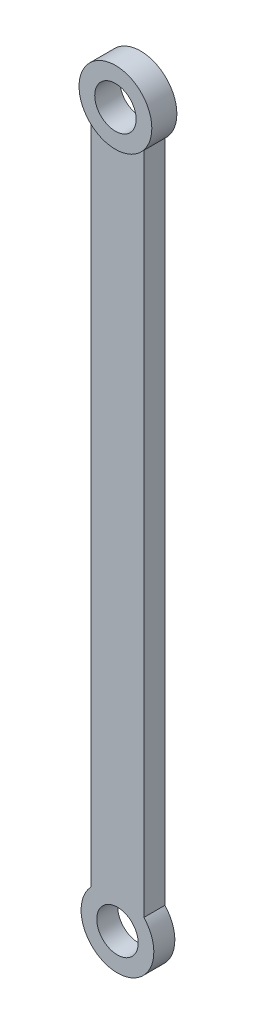
from build123d import *

# Parameters (mm, degrees)
CROQUIS1_R              = 5.125
SALIENTE_EXTRUIR1_DEPTH = 2.6
CROQUIS1_3_R            = 9
CROQUIS1_3_R_2          = 5.125
SALIENTE_EXTRUIR2_DEPTH = 3.1


with BuildPart() as part:
    # Croquis1 → Saliente-Extruir1 (new, symmetric)
    with BuildSketch(Plane.XY):
        with BuildLine():
            ThreePointArc((6.54, -6.182911935), (0, -9), (-6.54, -6.182911935))
            Line((-6.54, -6.182911935), (-6.54, -170.567088065))
            ThreePointArc((-6.54, -170.567088065), (0, -185.75), (6.54, -170.567088065))
            Line((6.54, -170.567088065), (6.54, -6.182911935))
        make_face()
        with Locations((0, -176.75)):
            Circle(CROQUIS1_R, mode=Mode.SUBTRACT)
    extrude(amount=SALIENTE_EXTRUIR1_DEPTH, both=True)

    # Croquis1<3> → Saliente-Extruir2 (add, symmetric)
    with BuildSketch(Plane.XY):
        Circle(CROQUIS1_3_R)
        with Locations(Location((0, 0, 0), (0, 0, 180))):
            Circle(CROQUIS1_3_R_2, mode=Mode.SUBTRACT)
    extrude(amount=SALIENTE_EXTRUIR2_DEPTH, both=True)


solid = part.part
